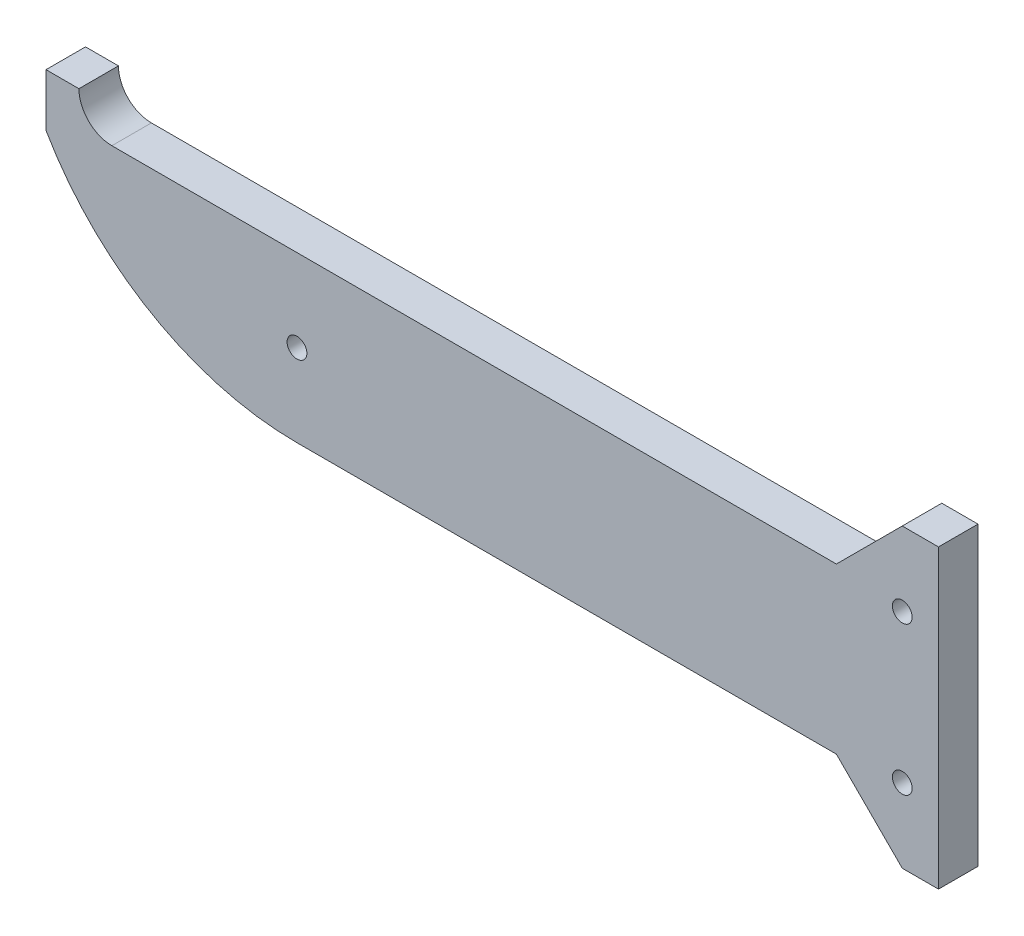
from build123d import *

# Parameters (mm, degrees)
SKETCH1_R           = 1.5
BOSS_EXTRUDE1_DEPTH = 6


with BuildPart() as part:
    # Sketch1 → Boss-Extrude1 (new body)
    with BuildSketch(Plane.XY):
        with BuildLine():
            Line((120, -25), (38.105117767, -25))
            ThreePointArc((38.105117767, -25), (16.105117767, -19.105117767), (0, -3))
            Line((0, -3), (0, 0))
            Line((0, 0), (0, 5))
            Line((0, 5), (5, 5))
            ThreePointArc((5, 5), (6.464466094, 1.464466094), (10, 0))
            Line((10, 0), (120, 0))
            Line((120, 0), (130, 10))
            Line((130, 10), (135.5, 10))
            Line((135.5, 10), (135.5, -35))
            Line((135.5, -35), (130, -35))
            Line((130, -35), (120, -25))
        make_face()
        with Locations((130, -1.25)):
            Circle(SKETCH1_R, mode=Mode.SUBTRACT)
        with Locations((130, -23.75)):
            Circle(SKETCH1_R, mode=Mode.SUBTRACT)
        with Locations((38.105117767, -12.5)):
            Circle(SKETCH1_R, mode=Mode.SUBTRACT)
    extrude(amount=BOSS_EXTRUDE1_DEPTH)


solid = part.part
